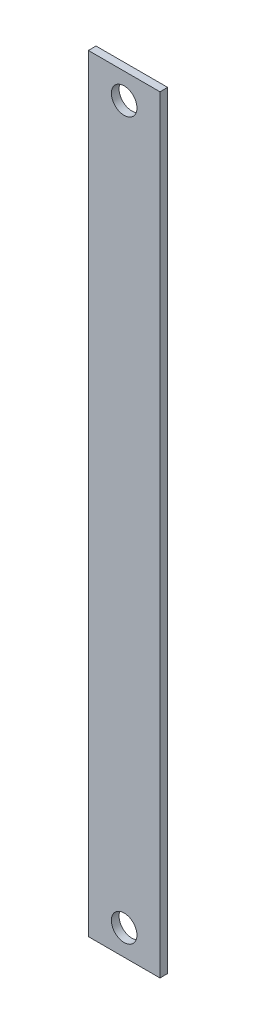
from build123d import *

# Parameters (mm, degrees)
CROQUIS1_W              = 28
CROQUIS1_H              = 300
SALIENTE_EXTRUIR1_DEPTH = 1.5
CROQUIS2_R              = 5
CORTAR_EXTRUIR1_DEPTH   = 151.681783902


with BuildPart() as part:
    # Croquis1 → Saliente-Extruir1 (new, symmetric)
    with BuildSketch(Plane.XY):
        Rectangle(CROQUIS1_W, CROQUIS1_H)
    extrude(amount=SALIENTE_EXTRUIR1_DEPTH, both=True)

    # Croquis2 → Cortar-Extruir1 (cut, through all)
    with BuildSketch(Plane(origin=(0, 0, -1.5), x_dir=(-1, 0, 0), z_dir=(0, 0, -1))):
        with Locations((0, 140)):
            Circle(CROQUIS2_R)
        with Locations(Location((0, -140, 0), (0, 0, 180))):
            Circle(CROQUIS2_R)
    extrude(amount=-CORTAR_EXTRUIR1_DEPTH, mode=Mode.SUBTRACT)


solid = part.part
